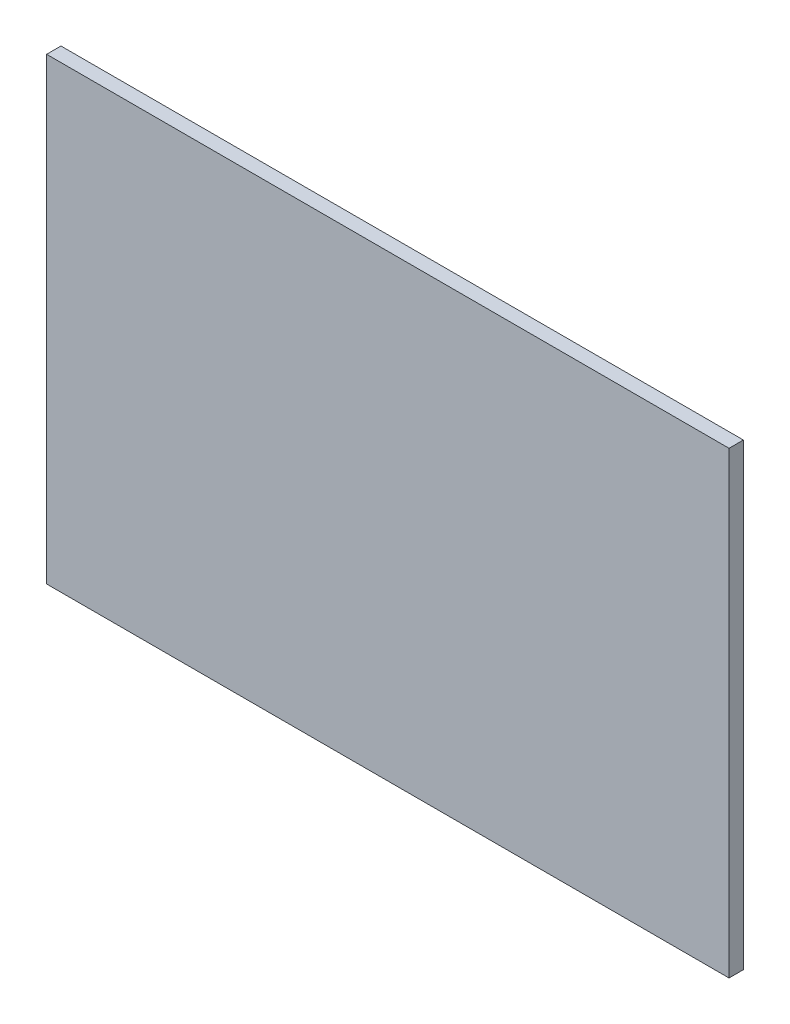
from build123d import *

# Parameters (mm, degrees)
SKETCH1_W           = 151.13
SKETCH1_H           = 101.6
BOSS_EXTRUDE1_DEPTH = 3.175


with BuildPart() as part:
    # Sketch1 → Boss-Extrude1 (new body)
    with BuildSketch(Plane.XY):
        Rectangle(SKETCH1_W, SKETCH1_H)
    extrude(amount=BOSS_EXTRUDE1_DEPTH)


solid = part.part
